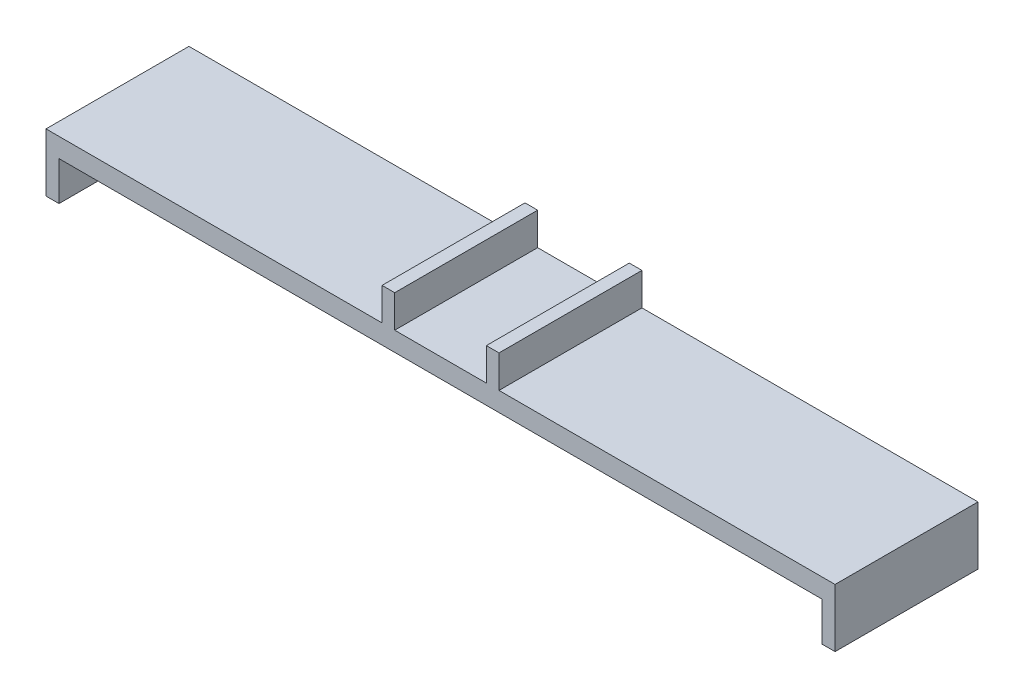
from build123d import *

# Parameters (mm, degrees)
BOSS_EXTRUDE2_DEPTH = 110
SKETCH3_W           = 9.744334313
SKETCH3_H           = 110
BOSS_EXTRUDE3_DEPTH = 30.2


with BuildPart() as part:
    # Sketch1 → Boss-Extrude2 (new body)
    with BuildSketch(Plane.XY):
        Polygon((0, 0), (10, 0), (10, 30), (597.2, 30), (597.2, 0), (607.2, 0), (607.2, 44.8), (0, 44.8), align=None)
    extrude(amount=BOSS_EXTRUDE2_DEPTH)

    # Sketch3 → Boss-Extrude3 (add)
    with BuildSketch(Plane(origin=(0, 39.6, 0), x_dir=(1, 0, 0), z_dir=(0, 1, 0))):
        with Locations((343.727832843, -55)):
            Rectangle(SKETCH3_W, SKETCH3_H)
        with Locations((263.472167157, -55)):
            Rectangle(SKETCH3_W, SKETCH3_H)
    extrude(amount=BOSS_EXTRUDE3_DEPTH)


solid = part.part
